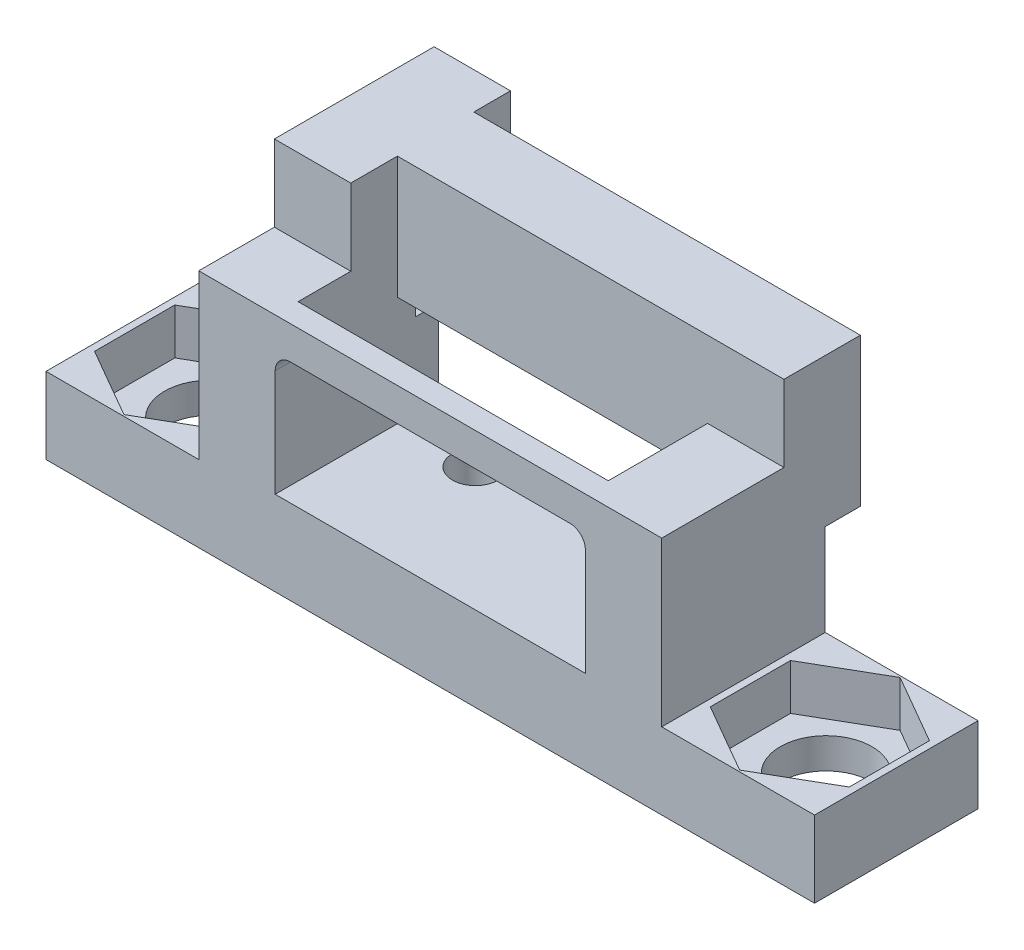
from build123d import *

# Parameters (mm, degrees)
CROQUIS1_W              = 50.3
CROQUIS1_H              = 10.7
SALIENTE_EXTRUIR1_DEPTH = 15.7
CORTAR_EXTRUIR1_REACH   = 55.769
CROQUIS2_W              = 10
CROQUIS2_H              = 10.7
CORTAR_EXTRUIR2_REACH   = 55.769
CROQUIS3_W              = 20.3
CROQUIS3_H              = 9.2
CORTAR_EXTRUIR3_REACH   = 46.554
CROQUIS4_W              = 1.5
CROQUIS4_H              = 4.7
CORTAR_EXTRUIR5_REACH   = 54.527
CROQUIS6_R              = 3
CORTAR_EXTRUIR6_REACH   = 54.421
CROQUIS7_R              = 1.5
CORTAR_EXTRUIR7_DEPTH   = 3
SALIENTE_EXTRUIR2_DEPTH = 5
CROQUIS11_W             = 5
CROQUIS11_H             = 4.7
SALIENTE_EXTRUIR3_DEPTH = 2.3
CROQUIS12_W             = 10
CROQUIS12_H             = 5
SALIENTE_EXTRUIR5_DEPTH = 3
CROQUIS13_W             = 15
CROQUIS13_H             = 5
SALIENTE_EXTRUIR6_DEPTH = 5
CROQUIS14_W             = 5
CROQUIS14_H             = 8
SALIENTE_EXTRUIR7_DEPTH = 10.3


with BuildPart() as part:
    # Croquis1 → Saliente-Extruir1 (new body)
    with BuildSketch(Plane(origin=(0, 0, 0), x_dir=(1, 0, 0), z_dir=(0, 1, 0))):
        with Locations((-25.15, -5.35)):
            Rectangle(CROQUIS1_W, CROQUIS1_H)
    extrude(amount=SALIENTE_EXTRUIR1_DEPTH)

    # Croquis2 → Cortar-Extruir1 (cut, up to next)
    with BuildSketch(Plane.XY.offset(10.7), mode=Mode.PRIVATE) as cortar_extruir1_sk1:
        with Locations((-45.3, 10.35)):
            Rectangle(CROQUIS2_W, CROQUIS2_H)
    cortar_extruir1_tool1 = extrude(cortar_extruir1_sk1.sketch, amount=-CORTAR_EXTRUIR1_REACH, mode=Mode.PRIVATE) & part.part
    # Croquis2 → Cortar-Extruir1 (cut, up to next)
    with BuildSketch(Plane.XY.offset(10.7), mode=Mode.PRIVATE) as cortar_extruir1_sk2:
        with BuildLine():
            Line((-35.3, 5.532906309), (-15, 5.532906309))
            Line((-15, 5.532906309), (-15, 12.532906309))
            ThreePointArc((-15, 12.532906309), (-15.292893219, 13.240013091), (-16, 13.532906309))
            Line((-16, 13.532906309), (-34.3, 13.532906309))
            ThreePointArc((-34.3, 13.532906309), (-35.007106781, 13.240013091), (-35.3, 12.532906309))
            Line((-35.3, 12.532906309), (-35.3, 5.532906309))
        make_face()
    cortar_extruir1_tool2 = extrude(cortar_extruir1_sk2.sketch, amount=-CORTAR_EXTRUIR1_REACH, mode=Mode.PRIVATE) & part.part
    # Croquis2 → Cortar-Extruir1 (cut, up to next)
    with BuildSketch(Plane.XY.offset(10.7), mode=Mode.PRIVATE) as cortar_extruir1_sk3:
        with Locations((-5, 10.35)):
            Rectangle(CROQUIS2_W, CROQUIS2_H)
    cortar_extruir1_tool3 = extrude(cortar_extruir1_sk3.sketch, amount=-CORTAR_EXTRUIR1_REACH, mode=Mode.PRIVATE) & part.part
    add(cortar_extruir1_tool1.solids().sort_by_distance((-45.3, 10.35, 10.7))[0], mode=Mode.SUBTRACT)
    add(cortar_extruir1_tool2.solids().sort_by_distance((-25.15, 9.522899, 10.7))[0], mode=Mode.SUBTRACT)
    add(cortar_extruir1_tool3.solids().sort_by_distance((-5, 10.35, 10.7))[0], mode=Mode.SUBTRACT)

    # Croquis3 → Cortar-Extruir2 (cut, up to next)
    with BuildSketch(Plane(origin=(0, 15.7, 0), x_dir=(1, 0, 0), z_dir=(0, 1, 0)), mode=Mode.PRIVATE) as cortar_extruir2_sk1:
        with Locations((-25.15, -4.6)):
            Rectangle(CROQUIS3_W, CROQUIS3_H)
    cortar_extruir2_tool1 = extrude(cortar_extruir2_sk1.sketch, amount=-CORTAR_EXTRUIR2_REACH, mode=Mode.PRIVATE) & part.part
    add(cortar_extruir2_tool1.solids().sort_by_distance((-25.15, 15.7, 4.6))[0], mode=Mode.SUBTRACT)

    # Croquis4 → Cortar-Extruir3 (cut, up to next)
    with BuildSketch(Plane.ZY.offset(40.3), mode=Mode.PRIVATE) as cortar_extruir3_sk1:
        with Locations((0.75, 13.35)):
            Rectangle(CROQUIS4_W, CROQUIS4_H)
    cortar_extruir3_tool1 = extrude(cortar_extruir3_sk1.sketch, amount=-CORTAR_EXTRUIR3_REACH, mode=Mode.PRIVATE) & part.part
    add(cortar_extruir3_tool1.solids().sort_by_distance((-40.3, 13.35, 0.75))[0], mode=Mode.SUBTRACT)

    # Croquis6 → Cortar-Extruir5 (cut, up to next)
    with BuildSketch(Plane(origin=(0, 5, 0), x_dir=(1, 0, 0), z_dir=(0, 1, 0)), mode=Mode.PRIVATE) as cortar_extruir5_sk1:
        with Locations(Location((-45.3, -4.941101113, 0), (0, 0, 270))):
            Circle(CROQUIS6_R)
    cortar_extruir5_tool1 = extrude(cortar_extruir5_sk1.sketch, amount=-CORTAR_EXTRUIR5_REACH, mode=Mode.PRIVATE) & part.part
    # Croquis6 → Cortar-Extruir5 (cut, up to next)
    with BuildSketch(Plane(origin=(0, 5, 0), x_dir=(1, 0, 0), z_dir=(0, 1, 0)), mode=Mode.PRIVATE) as cortar_extruir5_sk2:
        with Locations(Location((-5, -4.941101113, 0), (0, 0, 90))):
            Circle(CROQUIS6_R)
    cortar_extruir5_tool2 = extrude(cortar_extruir5_sk2.sketch, amount=-CORTAR_EXTRUIR5_REACH, mode=Mode.PRIVATE) & part.part
    add(cortar_extruir5_tool1.solids().sort_by_distance((-45.3, 5, 4.941101))[0], mode=Mode.SUBTRACT)
    add(cortar_extruir5_tool2.solids().sort_by_distance((-5, 5, 4.941101))[0], mode=Mode.SUBTRACT)

    # Croquis7 → Cortar-Extruir6 (cut, up to next)
    with BuildSketch(Plane(origin=(0, 5.532906309, 0), x_dir=(1, 0, 0), z_dir=(0, 1, 0)), mode=Mode.PRIVATE) as cortar_extruir6_sk1:
        with Locations(Location((-30.3, -2.6, 0), (0, 0, 270))):
            Circle(CROQUIS7_R)
    cortar_extruir6_tool1 = extrude(cortar_extruir6_sk1.sketch, amount=-CORTAR_EXTRUIR6_REACH, mode=Mode.PRIVATE) & part.part
    # Croquis7 → Cortar-Extruir6 (cut, up to next)
    with BuildSketch(Plane(origin=(0, 5.532906309, 0), x_dir=(1, 0, 0), z_dir=(0, 1, 0)), mode=Mode.PRIVATE) as cortar_extruir6_sk2:
        with Locations(Location((-20, -2.6, 0), (0, 0, 270))):
            Circle(CROQUIS7_R)
    cortar_extruir6_tool2 = extrude(cortar_extruir6_sk2.sketch, amount=-CORTAR_EXTRUIR6_REACH, mode=Mode.PRIVATE) & part.part
    add(cortar_extruir6_tool1.solids().sort_by_distance((-30.3, 5.532906, 2.6))[0], mode=Mode.SUBTRACT)
    add(cortar_extruir6_tool2.solids().sort_by_distance((-20, 5.532906, 2.6))[0], mode=Mode.SUBTRACT)

    # Croquis8 → Cortar-Extruir7 (cut)
    with BuildSketch(Plane(origin=(0, 5, 0), x_dir=(1, 0, 0), z_dir=(0, 1, 0))):
        Polygon((-5, -0.1), (-9.54663337, -2.725), (-9.54663337, -7.975), (-5, -10.6), (-0.45336663, -7.975), (-0.45336663, -2.725), align=None)
        Polygon((-49.84663337, -2.725), (-45.3, -0.1), (-40.75336663, -2.725), (-40.75336663, -7.975), (-45.3, -10.6), (-49.84663337, -7.975), align=None)
    extrude(amount=-CORTAR_EXTRUIR7_DEPTH, mode=Mode.SUBTRACT)

    # Croquis9 → Saliente-Extruir2 (add)
    with BuildSketch(Plane(origin=(-35.3, 0, 0), x_dir=(0, 0, -1), z_dir=(1, 0, 0))):
        Polygon((-1.5, 15.7), (2.7, 15.7), (2.7, 11), (4.7, 11), (4.7, 20.7), (-5.753105751, 20.7), (-5.753105751, 15.7), align=None)
    extrude(amount=-SALIENTE_EXTRUIR2_DEPTH)

    # Croquis11 → Saliente-Extruir3 (add)
    with BuildSketch(Plane(origin=(0, 0, 0), x_dir=(-1, 0, 0), z_dir=(0, 0, -1))):
        with Locations((12.5, 13.35)):
            Rectangle(CROQUIS11_W, CROQUIS11_H)
    extrude(amount=SALIENTE_EXTRUIR3_DEPTH)

    # Croquis12 → Saliente-Extruir5 (add)
    with BuildSketch(Plane(origin=(0, 15.7, 0), x_dir=(1, 0, 0), z_dir=(0, 1, 0))):
        with Locations((-20, -0.2)):
            Rectangle(CROQUIS12_W, CROQUIS12_H)
    extrude(amount=-SALIENTE_EXTRUIR5_DEPTH)

    # Croquis13 → Saliente-Extruir6 (add)
    with BuildSketch(Plane(origin=(0, 15.7, 0), x_dir=(1, 0, 0), z_dir=(0, 1, 0))):
        with Locations((-17.5, -0.2)):
            Rectangle(CROQUIS13_W, CROQUIS13_H)
    extrude(amount=SALIENTE_EXTRUIR6_DEPTH)

    # Croquis14 → Saliente-Extruir7 (add)
    with BuildSketch(Plane.ZY.offset(25)):
        with Locations((0.2, 16.7)):
            Rectangle(CROQUIS14_W, CROQUIS14_H)
    extrude(amount=SALIENTE_EXTRUIR7_DEPTH)


solid = part.part
